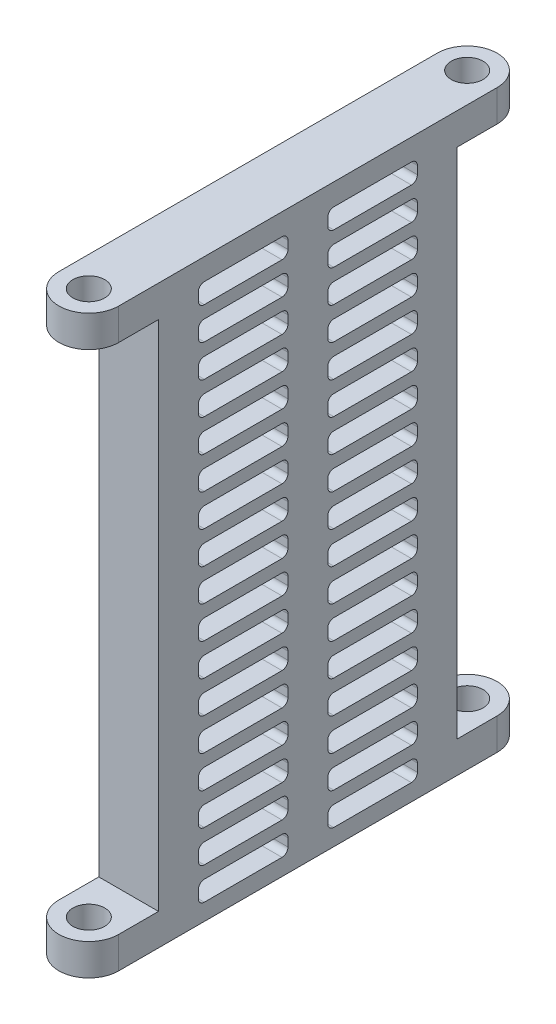
from build123d import *

# Parameters (mm, degrees)
SKETCH2_R           = 1.6
BOSS_EXTRUDE1_DEPTH = 3.175
SKETCH3_W           = 6
SKETCH3_H           = 30
BOSS_EXTRUDE2_DEPTH = 51.48
CUT_EXTRUDE1_DEPTH  = 72.142876664


with BuildPart() as part:
    # Sketch2 → Boss-Extrude1 (new body)
    with BuildSketch(Plane(origin=(0, 0, 0), x_dir=(1, 0, 0), z_dir=(0, 1, 0))):
        with BuildLine():
            Line((-3, 0), (-3, -38))
            ThreePointArc((-3, -38), (0, -41), (3, -38))
            Line((3, -38), (3, 0))
            ThreePointArc((3, 0), (0, 3), (-3, 0))
        make_face()
        with Locations(Location((0, 0, 0), (0, 0, 270))):
            Circle(SKETCH2_R, mode=Mode.SUBTRACT)
        with Locations(Location((0, -38, 0), (0, 0, 270))):
            Circle(SKETCH2_R, mode=Mode.SUBTRACT)
    boss_extrude1 = extrude(amount=BOSS_EXTRUDE1_DEPTH)

    # Sketch3 → Boss-Extrude2 (add)
    with BuildSketch(Plane(origin=(0, 3.175, 0), x_dir=(1, 0, 0), z_dir=(0, 1, 0))):
        with Locations((0, -19)):
            Rectangle(SKETCH3_W, SKETCH3_H)
    extrude(amount=BOSS_EXTRUDE2_DEPTH)

    # Mirror2: Boss-Extrude1 across plane
    add(boss_extrude1.mirror(Plane.ZX.offset(28.915)))

    # Sketch4 → Cut-Extrude1 (cut, through all)
    with BuildSketch(Plane(origin=(3, 0, 0), x_dir=(0, 0, -1), z_dir=(1, 0, 0))):
        with BuildLine():
            Line((-8.6, 13.42357141), (-16.4, 13.42357141))
            ThreePointArc((-16.4, 13.42357141), (-16.824264069, 13.247835479), (-17, 12.82357141))
            Line((-17, 12.82357141), (-17, 12.02357141))
            ThreePointArc((-17, 12.02357141), (-16.824264069, 11.599307341), (-16.4, 11.42357141))
            Line((-16.4, 11.42357141), (-8.6, 11.42357141))
            ThreePointArc((-8.6, 11.42357141), (-8.175735931, 11.599307341), (-8, 12.02357141))
            Line((-8, 12.02357141), (-8, 12.82357141))
            ThreePointArc((-8, 12.82357141), (-8.175735931, 13.247835479), (-8.6, 13.42357141))
        make_face()
        with BuildLine():
            Line((-8.6, 55.655), (-16.4, 55.655))
            ThreePointArc((-16.4, 55.655), (-16.824264069, 55.479264069), (-17, 55.055))
            Line((-17, 55.055), (-17, 54.255))
            ThreePointArc((-17, 54.255), (-16.824264069, 53.830735931), (-16.4, 53.655))
            Line((-16.4, 53.655), (-8.6, 53.655))
            ThreePointArc((-8.6, 53.655), (-8.175735931, 53.830735931), (-8, 54.255))
            Line((-8, 54.255), (-8, 55.055))
            ThreePointArc((-8, 55.055), (-8.175735931, 55.479264069), (-8.6, 55.655))
        make_face()
        with BuildLine():
            Line((-8.6, 52.40642857), (-16.4, 52.40642857))
            ThreePointArc((-16.4, 52.40642857), (-16.824264069, 52.230692639), (-17, 51.80642857))
            Line((-17, 51.80642857), (-17, 51.00642857))
            ThreePointArc((-17, 51.00642857), (-16.824264069, 50.582164501), (-16.4, 50.40642857))
            Line((-16.4, 50.40642857), (-8.6, 50.40642857))
            ThreePointArc((-8.6, 50.40642857), (-8.175735931, 50.582164501), (-8, 51.00642857))
            Line((-8, 51.00642857), (-8, 51.80642857))
            ThreePointArc((-8, 51.80642857), (-8.175735931, 52.230692639), (-8.6, 52.40642857))
        make_face()
        with BuildLine():
            Line((-8.6, 49.15785714), (-16.4, 49.15785714))
            ThreePointArc((-16.4, 49.15785714), (-16.824264069, 48.982121209), (-17, 48.55785714))
            Line((-17, 48.55785714), (-17, 47.75785714))
            ThreePointArc((-17, 47.75785714), (-16.824264069, 47.333593071), (-16.4, 47.15785714))
            Line((-16.4, 47.15785714), (-8.6, 47.15785714))
            ThreePointArc((-8.6, 47.15785714), (-8.175735931, 47.333593071), (-8, 47.75785714))
            Line((-8, 47.75785714), (-8, 48.55785714))
            ThreePointArc((-8, 48.55785714), (-8.175735931, 48.982121209), (-8.6, 49.15785714))
        make_face()
        with BuildLine():
            Line((-8.6, 45.90928571), (-16.4, 45.90928571))
            ThreePointArc((-16.4, 45.90928571), (-16.824264069, 45.733549779), (-17, 45.30928571))
            Line((-17, 45.30928571), (-17, 44.50928571))
            ThreePointArc((-17, 44.50928571), (-16.824264069, 44.085021641), (-16.4, 43.90928571))
            Line((-16.4, 43.90928571), (-8.6, 43.90928571))
            ThreePointArc((-8.6, 43.90928571), (-8.175735931, 44.085021641), (-8, 44.50928571))
            Line((-8, 44.50928571), (-8, 45.30928571))
            ThreePointArc((-8, 45.30928571), (-8.175735931, 45.733549779), (-8.6, 45.90928571))
        make_face()
        with BuildLine():
            Line((-8.6, 42.66071428), (-16.4, 42.66071428))
            ThreePointArc((-16.4, 42.66071428), (-16.824264069, 42.484978349), (-17, 42.06071428))
            Line((-17, 42.06071428), (-17, 41.26071428))
            ThreePointArc((-17, 41.26071428), (-16.824264069, 40.836450211), (-16.4, 40.66071428))
            Line((-16.4, 40.66071428), (-8.6, 40.66071428))
            ThreePointArc((-8.6, 40.66071428), (-8.175735931, 40.836450211), (-8, 41.26071428))
            Line((-8, 41.26071428), (-8, 42.06071428))
            ThreePointArc((-8, 42.06071428), (-8.175735931, 42.484978349), (-8.6, 42.66071428))
        make_face()
        with BuildLine():
            Line((-8.6, 39.41214285), (-16.4, 39.41214285))
            ThreePointArc((-16.4, 39.41214285), (-16.824264069, 39.236406919), (-17, 38.81214285))
            Line((-17, 38.81214285), (-17, 38.01214285))
            ThreePointArc((-17, 38.01214285), (-16.824264069, 37.587878781), (-16.4, 37.41214285))
            Line((-16.4, 37.41214285), (-8.6, 37.41214285))
            ThreePointArc((-8.6, 37.41214285), (-8.175735931, 37.587878781), (-8, 38.01214285))
            Line((-8, 38.01214285), (-8, 38.81214285))
            ThreePointArc((-8, 38.81214285), (-8.175735931, 39.236406919), (-8.6, 39.41214285))
        make_face()
        with BuildLine():
            Line((-8.6, 10.17499998), (-16.4, 10.17499998))
            ThreePointArc((-16.4, 10.17499998), (-16.824264069, 9.999264049), (-17, 9.57499998))
            Line((-17, 9.57499998), (-17, 8.77499998))
            ThreePointArc((-17, 8.77499998), (-16.824264069, 8.350735911), (-16.4, 8.17499998))
            Line((-16.4, 8.17499998), (-8.6, 8.17499998))
            ThreePointArc((-8.6, 8.17499998), (-8.175735931, 8.350735911), (-8, 8.77499998))
            Line((-8, 8.77499998), (-8, 9.57499998))
            ThreePointArc((-8, 9.57499998), (-8.175735931, 9.999264049), (-8.6, 10.17499998))
        make_face()
        with BuildLine():
            Line((-8.6, 36.16357142), (-16.4, 36.16357142))
            ThreePointArc((-16.4, 36.16357142), (-16.824264069, 35.987835489), (-17, 35.56357142))
            Line((-17, 35.56357142), (-17, 34.76357142))
            ThreePointArc((-17, 34.76357142), (-16.824264069, 34.339307351), (-16.4, 34.16357142))
            Line((-16.4, 34.16357142), (-8.6, 34.16357142))
            ThreePointArc((-8.6, 34.16357142), (-8.175735931, 34.339307351), (-8, 34.76357142))
            Line((-8, 34.76357142), (-8, 35.56357142))
            ThreePointArc((-8, 35.56357142), (-8.175735931, 35.987835489), (-8.6, 36.16357142))
        make_face()
        with BuildLine():
            Line((-8.6, 32.91499999), (-16.4, 32.91499999))
            ThreePointArc((-16.4, 32.91499999), (-16.824264069, 32.739264059), (-17, 32.31499999))
            Line((-17, 32.31499999), (-17, 31.51499999))
            ThreePointArc((-17, 31.51499999), (-16.824264069, 31.090735921), (-16.4, 30.91499999))
            Line((-16.4, 30.91499999), (-8.6, 30.91499999))
            ThreePointArc((-8.6, 30.91499999), (-8.175735931, 31.090735921), (-8, 31.51499999))
            Line((-8, 31.51499999), (-8, 32.31499999))
            ThreePointArc((-8, 32.31499999), (-8.175735931, 32.739264059), (-8.6, 32.91499999))
        make_face()
        with BuildLine():
            Line((-8.6, 29.66642856), (-16.4, 29.66642856))
            ThreePointArc((-16.4, 29.66642856), (-16.824264069, 29.490692629), (-17, 29.06642856))
            Line((-17, 29.06642856), (-17, 28.26642856))
            ThreePointArc((-17, 28.26642856), (-16.824264069, 27.842164491), (-16.4, 27.66642856))
            Line((-16.4, 27.66642856), (-8.6, 27.66642856))
            ThreePointArc((-8.6, 27.66642856), (-8.175735931, 27.842164491), (-8, 28.26642856))
            Line((-8, 28.26642856), (-8, 29.06642856))
            ThreePointArc((-8, 29.06642856), (-8.175735931, 29.490692629), (-8.6, 29.66642856))
        make_face()
        with BuildLine():
            Line((-8.6, 26.41785713), (-16.4, 26.41785713))
            ThreePointArc((-16.4, 26.41785713), (-16.824264069, 26.242121199), (-17, 25.81785713))
            Line((-17, 25.81785713), (-17, 25.01785713))
            ThreePointArc((-17, 25.01785713), (-16.824264069, 24.593593061), (-16.4, 24.41785713))
            Line((-16.4, 24.41785713), (-8.6, 24.41785713))
            ThreePointArc((-8.6, 24.41785713), (-8.175735931, 24.593593061), (-8, 25.01785713))
            Line((-8, 25.01785713), (-8, 25.81785713))
            ThreePointArc((-8, 25.81785713), (-8.175735931, 26.242121199), (-8.6, 26.41785713))
        make_face()
        with BuildLine():
            Line((-8.6, 23.1692857), (-16.4, 23.1692857))
            ThreePointArc((-16.4, 23.1692857), (-16.824264069, 22.993549769), (-17, 22.5692857))
            Line((-17, 22.5692857), (-17, 21.7692857))
            ThreePointArc((-17, 21.7692857), (-16.824264069, 21.345021631), (-16.4, 21.1692857))
            Line((-16.4, 21.1692857), (-8.6, 21.1692857))
            ThreePointArc((-8.6, 21.1692857), (-8.175735931, 21.345021631), (-8, 21.7692857))
            Line((-8, 21.7692857), (-8, 22.5692857))
            ThreePointArc((-8, 22.5692857), (-8.175735931, 22.993549769), (-8.6, 23.1692857))
        make_face()
        with BuildLine():
            Line((-8.6, 19.92071427), (-16.4, 19.92071427))
            ThreePointArc((-16.4, 19.92071427), (-16.824264069, 19.744978339), (-17, 19.32071427))
            Line((-17, 19.32071427), (-17, 18.52071427))
            ThreePointArc((-17, 18.52071427), (-16.824264069, 18.096450201), (-16.4, 17.92071427))
            Line((-16.4, 17.92071427), (-8.6, 17.92071427))
            ThreePointArc((-8.6, 17.92071427), (-8.175735931, 18.096450201), (-8, 18.52071427))
            Line((-8, 18.52071427), (-8, 19.32071427))
            ThreePointArc((-8, 19.32071427), (-8.175735931, 19.744978339), (-8.6, 19.92071427))
        make_face()
        with BuildLine():
            Line((-8.6, 16.67214284), (-16.4, 16.67214284))
            ThreePointArc((-16.4, 16.67214284), (-16.824264069, 16.496406909), (-17, 16.07214284))
            Line((-17, 16.07214284), (-17, 15.27214284))
            ThreePointArc((-17, 15.27214284), (-16.824264069, 14.847878771), (-16.4, 14.67214284))
            Line((-16.4, 14.67214284), (-8.6, 14.67214284))
            ThreePointArc((-8.6, 14.67214284), (-8.175735931, 14.847878771), (-8, 15.27214284))
            Line((-8, 15.27214284), (-8, 16.07214284))
            ThreePointArc((-8, 16.07214284), (-8.175735931, 16.496406909), (-8.6, 16.67214284))
        make_face()
        with BuildLine():
            Line((-8.6, 6.92642855), (-16.4, 6.92642855))
            ThreePointArc((-16.4, 6.92642855), (-16.824264069, 6.750692619), (-17, 6.32642855))
            Line((-17, 6.32642855), (-17, 5.52642855))
            ThreePointArc((-17, 5.52642855), (-16.824264069, 5.102164481), (-16.4, 4.92642855))
            Line((-16.4, 4.92642855), (-8.6, 4.92642855))
            ThreePointArc((-8.6, 4.92642855), (-8.175735931, 5.102164481), (-8, 5.52642855))
            Line((-8, 5.52642855), (-8, 6.32642855))
            ThreePointArc((-8, 6.32642855), (-8.175735931, 6.750692619), (-8.6, 6.92642855))
        make_face()
        with BuildLine():
            Line((-8.6, 3.67785712), (-16.4, 3.67785712))
            ThreePointArc((-16.4, 3.67785712), (-16.824264069, 3.502121189), (-17, 3.07785712))
            Line((-17, 3.07785712), (-17, 2.27785712))
            ThreePointArc((-17, 2.27785712), (-16.824264069, 1.853593051), (-16.4, 1.67785712))
            Line((-16.4, 1.67785712), (-8.6, 1.67785712))
            ThreePointArc((-8.6, 1.67785712), (-8.175735931, 1.853593051), (-8, 2.27785712))
            Line((-8, 2.27785712), (-8, 3.07785712))
            ThreePointArc((-8, 3.07785712), (-8.175735931, 3.502121189), (-8.6, 3.67785712))
        make_face()
        with BuildLine():
            Line((-21, 3.07785712), (-21, 2.27785712))
            ThreePointArc((-21, 2.27785712), (-21.175735931, 1.853593051), (-21.6, 1.67785712))
            Line((-21.6, 1.67785712), (-29.4, 1.67785712))
            ThreePointArc((-29.4, 1.67785712), (-29.824264069, 1.853593051), (-30, 2.27785712))
            Line((-30, 2.27785712), (-30, 3.07785712))
            ThreePointArc((-30, 3.07785712), (-29.824264069, 3.502121189), (-29.4, 3.67785712))
            Line((-29.4, 3.67785712), (-21.6, 3.67785712))
            ThreePointArc((-21.6, 3.67785712), (-21.175735931, 3.502121189), (-21, 3.07785712))
        make_face()
        with BuildLine():
            Line((-21, 6.32642855), (-21, 5.52642855))
            ThreePointArc((-21, 5.52642855), (-21.175735931, 5.102164481), (-21.6, 4.92642855))
            Line((-21.6, 4.92642855), (-29.4, 4.92642855))
            ThreePointArc((-29.4, 4.92642855), (-29.824264069, 5.102164481), (-30, 5.52642855))
            Line((-30, 5.52642855), (-30, 6.32642855))
            ThreePointArc((-30, 6.32642855), (-29.824264069, 6.750692619), (-29.4, 6.92642855))
            Line((-29.4, 6.92642855), (-21.6, 6.92642855))
            ThreePointArc((-21.6, 6.92642855), (-21.175735931, 6.750692619), (-21, 6.32642855))
        make_face()
        with BuildLine():
            Line((-21, 16.07214284), (-21, 15.27214284))
            ThreePointArc((-21, 15.27214284), (-21.175735931, 14.847878771), (-21.6, 14.67214284))
            Line((-21.6, 14.67214284), (-29.4, 14.67214284))
            ThreePointArc((-29.4, 14.67214284), (-29.824264069, 14.847878771), (-30, 15.27214284))
            Line((-30, 15.27214284), (-30, 16.07214284))
            ThreePointArc((-30, 16.07214284), (-29.824264069, 16.496406909), (-29.4, 16.67214284))
            Line((-29.4, 16.67214284), (-21.6, 16.67214284))
            ThreePointArc((-21.6, 16.67214284), (-21.175735931, 16.496406909), (-21, 16.07214284))
        make_face()
        with BuildLine():
            Line((-21, 19.32071427), (-21, 18.52071427))
            ThreePointArc((-21, 18.52071427), (-21.175735931, 18.096450201), (-21.6, 17.92071427))
            Line((-21.6, 17.92071427), (-29.4, 17.92071427))
            ThreePointArc((-29.4, 17.92071427), (-29.824264069, 18.096450201), (-30, 18.52071427))
            Line((-30, 18.52071427), (-30, 19.32071427))
            ThreePointArc((-30, 19.32071427), (-29.824264069, 19.744978339), (-29.4, 19.92071427))
            Line((-29.4, 19.92071427), (-21.6, 19.92071427))
            ThreePointArc((-21.6, 19.92071427), (-21.175735931, 19.744978339), (-21, 19.32071427))
        make_face()
        with BuildLine():
            Line((-21, 22.5692857), (-21, 21.7692857))
            ThreePointArc((-21, 21.7692857), (-21.175735931, 21.345021631), (-21.6, 21.1692857))
            Line((-21.6, 21.1692857), (-29.4, 21.1692857))
            ThreePointArc((-29.4, 21.1692857), (-29.824264069, 21.345021631), (-30, 21.7692857))
            Line((-30, 21.7692857), (-30, 22.5692857))
            ThreePointArc((-30, 22.5692857), (-29.824264069, 22.993549769), (-29.4, 23.1692857))
            Line((-29.4, 23.1692857), (-21.6, 23.1692857))
            ThreePointArc((-21.6, 23.1692857), (-21.175735931, 22.993549769), (-21, 22.5692857))
        make_face()
        with BuildLine():
            Line((-21, 25.81785713), (-21, 25.01785713))
            ThreePointArc((-21, 25.01785713), (-21.175735931, 24.593593061), (-21.6, 24.41785713))
            Line((-21.6, 24.41785713), (-29.4, 24.41785713))
            ThreePointArc((-29.4, 24.41785713), (-29.824264069, 24.593593061), (-30, 25.01785713))
            Line((-30, 25.01785713), (-30, 25.81785713))
            ThreePointArc((-30, 25.81785713), (-29.824264069, 26.242121199), (-29.4, 26.41785713))
            Line((-29.4, 26.41785713), (-21.6, 26.41785713))
            ThreePointArc((-21.6, 26.41785713), (-21.175735931, 26.242121199), (-21, 25.81785713))
        make_face()
        with BuildLine():
            Line((-21, 29.06642856), (-21, 28.26642856))
            ThreePointArc((-21, 28.26642856), (-21.175735931, 27.842164491), (-21.6, 27.66642856))
            Line((-21.6, 27.66642856), (-29.4, 27.66642856))
            ThreePointArc((-29.4, 27.66642856), (-29.824264069, 27.842164491), (-30, 28.26642856))
            Line((-30, 28.26642856), (-30, 29.06642856))
            ThreePointArc((-30, 29.06642856), (-29.824264069, 29.490692629), (-29.4, 29.66642856))
            Line((-29.4, 29.66642856), (-21.6, 29.66642856))
            ThreePointArc((-21.6, 29.66642856), (-21.175735931, 29.490692629), (-21, 29.06642856))
        make_face()
        with BuildLine():
            Line((-21, 32.31499999), (-21, 31.51499999))
            ThreePointArc((-21, 31.51499999), (-21.175735931, 31.090735921), (-21.6, 30.91499999))
            Line((-21.6, 30.91499999), (-29.4, 30.91499999))
            ThreePointArc((-29.4, 30.91499999), (-29.824264069, 31.090735921), (-30, 31.51499999))
            Line((-30, 31.51499999), (-30, 32.31499999))
            ThreePointArc((-30, 32.31499999), (-29.824264069, 32.739264059), (-29.4, 32.91499999))
            Line((-29.4, 32.91499999), (-21.6, 32.91499999))
            ThreePointArc((-21.6, 32.91499999), (-21.175735931, 32.739264059), (-21, 32.31499999))
        make_face()
        with BuildLine():
            Line((-21, 35.56357142), (-21, 34.76357142))
            ThreePointArc((-21, 34.76357142), (-21.175735931, 34.339307351), (-21.6, 34.16357142))
            Line((-21.6, 34.16357142), (-29.4, 34.16357142))
            ThreePointArc((-29.4, 34.16357142), (-29.824264069, 34.339307351), (-30, 34.76357142))
            Line((-30, 34.76357142), (-30, 35.56357142))
            ThreePointArc((-30, 35.56357142), (-29.824264069, 35.987835489), (-29.4, 36.16357142))
            Line((-29.4, 36.16357142), (-21.6, 36.16357142))
            ThreePointArc((-21.6, 36.16357142), (-21.175735931, 35.987835489), (-21, 35.56357142))
        make_face()
        with BuildLine():
            Line((-21, 38.81214285), (-21, 38.01214285))
            ThreePointArc((-21, 38.01214285), (-21.175735931, 37.587878781), (-21.6, 37.41214285))
            Line((-21.6, 37.41214285), (-29.4, 37.41214285))
            ThreePointArc((-29.4, 37.41214285), (-29.824264069, 37.587878781), (-30, 38.01214285))
            Line((-30, 38.01214285), (-30, 38.81214285))
            ThreePointArc((-30, 38.81214285), (-29.824264069, 39.236406919), (-29.4, 39.41214285))
            Line((-29.4, 39.41214285), (-21.6, 39.41214285))
            ThreePointArc((-21.6, 39.41214285), (-21.175735931, 39.236406919), (-21, 38.81214285))
        make_face()
        with BuildLine():
            Line((-21, 9.57499998), (-21, 8.77499998))
            ThreePointArc((-21, 8.77499998), (-21.175735931, 8.350735911), (-21.6, 8.17499998))
            Line((-21.6, 8.17499998), (-29.4, 8.17499998))
            ThreePointArc((-29.4, 8.17499998), (-29.824264069, 8.350735911), (-30, 8.77499998))
            Line((-30, 8.77499998), (-30, 9.57499998))
            ThreePointArc((-30, 9.57499998), (-29.824264069, 9.999264049), (-29.4, 10.17499998))
            Line((-29.4, 10.17499998), (-21.6, 10.17499998))
            ThreePointArc((-21.6, 10.17499998), (-21.175735931, 9.999264049), (-21, 9.57499998))
        make_face()
        with BuildLine():
            Line((-21, 42.06071428), (-21, 41.26071428))
            ThreePointArc((-21, 41.26071428), (-21.175735931, 40.836450211), (-21.6, 40.66071428))
            Line((-21.6, 40.66071428), (-29.4, 40.66071428))
            ThreePointArc((-29.4, 40.66071428), (-29.824264069, 40.836450211), (-30, 41.26071428))
            Line((-30, 41.26071428), (-30, 42.06071428))
            ThreePointArc((-30, 42.06071428), (-29.824264069, 42.484978349), (-29.4, 42.66071428))
            Line((-29.4, 42.66071428), (-21.6, 42.66071428))
            ThreePointArc((-21.6, 42.66071428), (-21.175735931, 42.484978349), (-21, 42.06071428))
        make_face()
        with BuildLine():
            Line((-21, 45.30928571), (-21, 44.50928571))
            ThreePointArc((-21, 44.50928571), (-21.175735931, 44.085021641), (-21.6, 43.90928571))
            Line((-21.6, 43.90928571), (-29.4, 43.90928571))
            ThreePointArc((-29.4, 43.90928571), (-29.824264069, 44.085021641), (-30, 44.50928571))
            Line((-30, 44.50928571), (-30, 45.30928571))
            ThreePointArc((-30, 45.30928571), (-29.824264069, 45.733549779), (-29.4, 45.90928571))
            Line((-29.4, 45.90928571), (-21.6, 45.90928571))
            ThreePointArc((-21.6, 45.90928571), (-21.175735931, 45.733549779), (-21, 45.30928571))
        make_face()
        with BuildLine():
            Line((-21, 48.55785714), (-21, 47.75785714))
            ThreePointArc((-21, 47.75785714), (-21.175735931, 47.333593071), (-21.6, 47.15785714))
            Line((-21.6, 47.15785714), (-29.4, 47.15785714))
            ThreePointArc((-29.4, 47.15785714), (-29.824264069, 47.333593071), (-30, 47.75785714))
            Line((-30, 47.75785714), (-30, 48.55785714))
            ThreePointArc((-30, 48.55785714), (-29.824264069, 48.982121209), (-29.4, 49.15785714))
            Line((-29.4, 49.15785714), (-21.6, 49.15785714))
            ThreePointArc((-21.6, 49.15785714), (-21.175735931, 48.982121209), (-21, 48.55785714))
        make_face()
        with BuildLine():
            Line((-21, 51.80642857), (-21, 51.00642857))
            ThreePointArc((-21, 51.00642857), (-21.175735931, 50.582164501), (-21.6, 50.40642857))
            Line((-21.6, 50.40642857), (-29.4, 50.40642857))
            ThreePointArc((-29.4, 50.40642857), (-29.824264069, 50.582164501), (-30, 51.00642857))
            Line((-30, 51.00642857), (-30, 51.80642857))
            ThreePointArc((-30, 51.80642857), (-29.824264069, 52.230692639), (-29.4, 52.40642857))
            Line((-29.4, 52.40642857), (-21.6, 52.40642857))
            ThreePointArc((-21.6, 52.40642857), (-21.175735931, 52.230692639), (-21, 51.80642857))
        make_face()
        with BuildLine():
            Line((-21, 55.055), (-21, 54.255))
            ThreePointArc((-21, 54.255), (-21.175735931, 53.830735931), (-21.6, 53.655))
            Line((-21.6, 53.655), (-29.4, 53.655))
            ThreePointArc((-29.4, 53.655), (-29.824264069, 53.830735931), (-30, 54.255))
            Line((-30, 54.255), (-30, 55.055))
            ThreePointArc((-30, 55.055), (-29.824264069, 55.479264069), (-29.4, 55.655))
            Line((-29.4, 55.655), (-21.6, 55.655))
            ThreePointArc((-21.6, 55.655), (-21.175735931, 55.479264069), (-21, 55.055))
        make_face()
        with BuildLine():
            Line((-21, 12.82357141), (-21, 12.02357141))
            ThreePointArc((-21, 12.02357141), (-21.175735931, 11.599307341), (-21.6, 11.42357141))
            Line((-21.6, 11.42357141), (-29.4, 11.42357141))
            ThreePointArc((-29.4, 11.42357141), (-29.824264069, 11.599307341), (-30, 12.02357141))
            Line((-30, 12.02357141), (-30, 12.82357141))
            ThreePointArc((-30, 12.82357141), (-29.824264069, 13.247835479), (-29.4, 13.42357141))
            Line((-29.4, 13.42357141), (-21.6, 13.42357141))
            ThreePointArc((-21.6, 13.42357141), (-21.175735931, 13.247835479), (-21, 12.82357141))
        make_face()
    extrude(amount=-CUT_EXTRUDE1_DEPTH, mode=Mode.SUBTRACT)


solid = part.part
